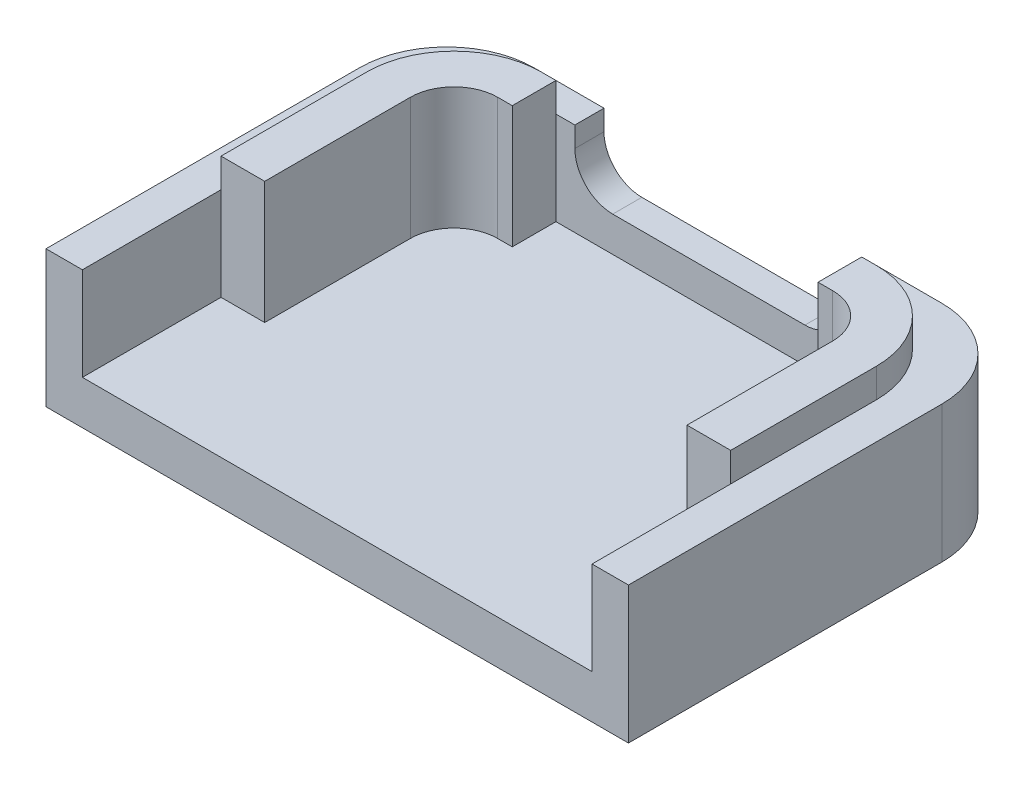
from build123d import *

# Parameters (mm, degrees)
BOSS_EXTRUDE1_DEPTH = 1.5
BOSS_EXTRUDE2_START = 3.2
BOSS_EXTRUDE2_DEPTH = 3.2
BOSS_EXTRUDE3_START = 4.2
BOSS_EXTRUDE3_DEPTH = 4.2
CUT_EXTRUDE1_DEPTH  = 24.43560539


with BuildPart() as part:
    # Sketch1 → Boss-Extrude1 (new body)
    with BuildSketch(Plane(origin=(0, 0, 0), x_dir=(1, 0, 0), z_dir=(0, 1, 0))):
        with BuildLine():
            Line((-1.5, 20.46), (-1.5, 9.7))
            Line((-1.5, 9.7), (18.5, 9.7))
            Line((18.5, 9.7), (18.5, 20.46))
            ThreePointArc((18.5, 20.46), (17.621320344, 22.581320344), (15.5, 23.46))
            Line((15.5, 23.46), (1.5, 23.46))
            ThreePointArc((1.5, 23.46), (-0.621320344, 22.581320344), (-1.5, 20.46))
        make_face()
    extrude(amount=-BOSS_EXTRUDE1_DEPTH)

    # Sketch3 → Boss-Extrude2 (add)
    with BuildSketch(Plane(origin=(0, 0, 0), x_dir=(1, 0, 0), z_dir=(0, 1, 0)).offset(BOSS_EXTRUDE2_START)):
        with BuildLine():
            Line((2.75, 22.46), (14.25, 22.46))
            ThreePointArc((14.25, 22.46), (16.371320344, 21.581320344), (17.25, 19.46))
            Line((17.25, 19.46), (17.25, 9.7))
            Line((17.25, 9.7), (18.5, 9.7))
            Line((18.5, 9.7), (18.5, 20.46))
            ThreePointArc((18.5, 20.46), (17.621320344, 22.581320344), (15.5, 23.46))
            Line((15.5, 23.46), (1.5, 23.46))
            ThreePointArc((1.5, 23.46), (-0.621320344, 22.581320344), (-1.5, 20.46))
            Line((-1.5, 20.46), (-1.5, 9.7))
            Line((-1.5, 9.7), (-0.25, 9.7))
            Line((-0.25, 9.7), (-0.25, 19.46))
            ThreePointArc((-0.25, 19.46), (0.628679656, 21.581320344), (2.75, 22.46))
        make_face()
    extrude(amount=-BOSS_EXTRUDE2_DEPTH)

    # Sketch2 → Boss-Extrude3 (add)
    with BuildSketch(Plane(origin=(0, 0, 0), x_dir=(1, 0, 0), z_dir=(0, 1, 0)).offset(BOSS_EXTRUDE3_START)):
        with BuildLine():
            Line((2.75, 20.96), (3.25, 20.96))
            Line((3.25, 20.96), (3.25, 22.46))
            Line((3.25, 22.46), (2.75, 22.46))
            ThreePointArc((2.75, 22.46), (0.628679656, 21.581320344), (-0.25, 19.46))
            Line((-0.25, 19.46), (-0.25, 14.46))
            Line((-0.25, 14.46), (1.25, 14.46))
            Line((1.25, 14.46), (1.25, 19.46))
            ThreePointArc((1.25, 19.46), (1.689339828, 20.520660172), (2.75, 20.96))
        make_face()
        with BuildLine():
            Line((17.25, 19.46), (17.25, 14.46))
            Line((17.25, 14.46), (15.75, 14.46))
            Line((15.75, 14.46), (15.75, 19.46))
            ThreePointArc((15.75, 19.46), (15.310660172, 20.520660172), (14.25, 20.96))
            Line((14.25, 20.96), (13.75, 20.96))
            Line((13.75, 20.96), (13.75, 22.46))
            Line((13.75, 22.46), (14.25, 22.46))
            ThreePointArc((14.25, 22.46), (16.371320344, 21.581320344), (17.25, 19.46))
        make_face()
    extrude(amount=-BOSS_EXTRUDE3_DEPTH)

    # Sketch5 → Cut-Extrude1 (cut, through all)
    with BuildSketch(Plane(origin=(0, 0, -23.46), x_dir=(-1, 0, 0), z_dir=(0, 0, -1))):
        with BuildLine():
            Line((-13.1, 3.2), (-3.9, 3.2))
            Line((-3.9, 3.2), (-3.9, 2.5))
            ThreePointArc((-3.9, 2.5), (-4.280761184, 1.580761184), (-5.2, 1.2))
            Line((-5.2, 1.2), (-11.8, 1.2))
            ThreePointArc((-11.8, 1.2), (-12.719238816, 1.580761184), (-13.1, 2.5))
            Line((-13.1, 2.5), (-13.1, 3.2))
        make_face()
    extrude(amount=-CUT_EXTRUDE1_DEPTH, mode=Mode.SUBTRACT)


solid = part.part
